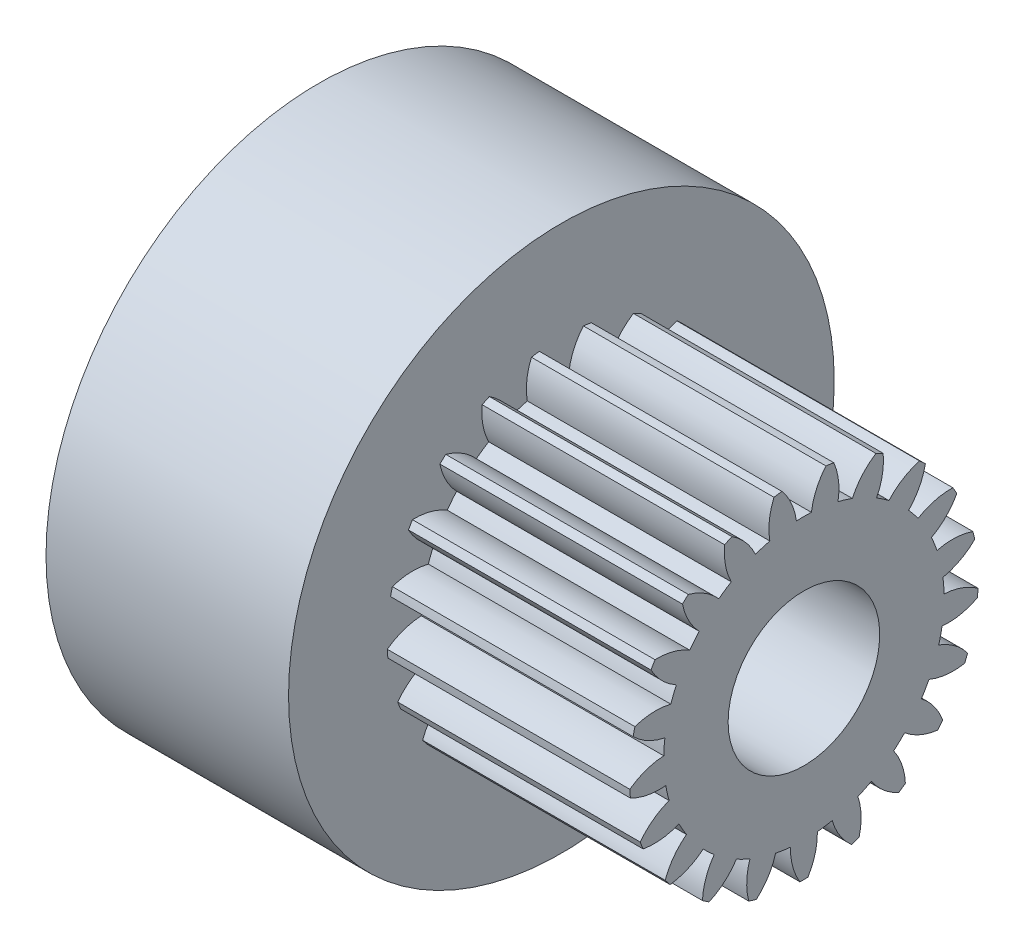
from build123d import *
from build123d.topology import SkipClean

# Parameters (mm, degrees)
BASPROSKE_W         = 8
BASPROSKE_H         = 5.75
TOOTHCUT_DEPTH      = 12.407234547
TEETHCUTS_COUNT     = 21
TEETHCUTS_ANGLE     = 342.857142857
HUBNEARONE_START    = 8.0000508
HUBNEAONESKE_R      = 4.624
HUBNEARONE_DEPTH    = 8.0000508
BORSKE_R            = 2.5
BORE_DEPTH          = 16.0000508
SKETCH1_R           = 9
SKETCH1_R_2         = 4.624
BOSS_EXTRUDE1_DEPTH = 8.0000508
SKETCH3_R           = 1.8
CUT_EXTRUDE1_DEPTH  = 16.033323412
SKETCH4_W           = 5.5
SKETCH4_H           = 2.2
CUT_EXTRUDE2_DEPTH  = 5.5


with BuildPart() as part:
    # BasProSke → Base-Revolve (revolve)
    with BuildSketch(Plane(origin=(0, 0, 0), x_dir=(1, 0, 0), z_dir=(0, 1, 0)), mode=Mode.PRIVATE) as base_revolve_sk:
        with Locations((4, 2.875)):
            Rectangle(BASPROSKE_W, BASPROSKE_H)
    revolve(base_revolve_sk.sketch.rotate(Axis((-10, 0, 0), (1, 0, 0)), 180), axis=Axis((-10, 0, 0), (1, 0, 0)))

    # TooCutSke → ToothCut (cut, through all)
    with BuildSketch(Plane(origin=(0, 0, 0), x_dir=(0, 0, -1), z_dir=(1, 0, 0))):
        with BuildLine():
            ThreePointArc((0.247570178, 4.617367757), (0, 4.624), (-0.247570178, 4.617367757))
            ThreePointArc((-0.247570178, 4.617367757), (-0.414765128, 5.209076442), (-0.746177874, 5.726994302))
            ThreePointArc((-0.746177874, 5.726994302), (0, 5.7754), (0.746177874, 5.726994302))
            ThreePointArc((0.746177874, 5.726994302), (0.414765128, 5.209076442), (0.247570178, 4.617367757))
        make_face()
    toothcut = extrude(amount=TOOTHCUT_DEPTH, mode=Mode.SUBTRACT)

    # TeethCuts: ToothCut ×21 about axis
    teethcuts_axis = Axis((-10, 0, 0), (1, 0, 0))
    for i in range(1, TEETHCUTS_COUNT):
        add(toothcut.rotate(teethcuts_axis, i * TEETHCUTS_ANGLE / (TEETHCUTS_COUNT - 1)), mode=Mode.SUBTRACT)

    # HubNeaOneSke → HubNearOne (add)
    with SkipClean():  # the faces are left unmerged after this step: merging them gives an invalid solid
        with BuildSketch(Plane.ZY.offset(HUBNEARONE_START)):
            Circle(HUBNEAONESKE_R)
        extrude(amount=-HUBNEARONE_DEPTH)

    # BorSke → Bore (cut, symmetric)
    with SkipClean():  # the faces are left unmerged after this step: merging them gives an invalid solid
        with BuildSketch(Plane(origin=(0, 0, 0), x_dir=(0, 0, -1), z_dir=(1, 0, 0))):
            with Locations(Location((0, 0, 0), (0, 0, 180))):
                Circle(BORSKE_R)
        extrude(amount=BORE_DEPTH, both=True, mode=Mode.SUBTRACT)

    # Sketch1 → Boss-Extrude1 (add)
    with BuildSketch(Plane.ZY.offset(8.0000508)):
        Circle(SKETCH1_R)
        Circle(SKETCH1_R_2, mode=Mode.SUBTRACT)
    extrude(amount=-BOSS_EXTRUDE1_DEPTH)

    # Sketch3 → Cut-Extrude1 (cut, through all)
    with BuildSketch(Plane(origin=(0, 0, 0), x_dir=(1, 0, 0), z_dir=(0, 1, 0))):
        with Locations(Location((-5.2500508, 0, 0), (0, 0, 270))):
            Circle(SKETCH3_R)
    extrude(amount=-CUT_EXTRUDE1_DEPTH, mode=Mode.SUBTRACT)

    # Sketch4 → Cut-Extrude2 (cut)
    with BuildSketch(Plane.ZY.offset(8.0000508)):
        with Locations((0, -5)):
            Rectangle(SKETCH4_W, SKETCH4_H)
    extrude(amount=-CUT_EXTRUDE2_DEPTH, mode=Mode.SUBTRACT)


solid = part.part
